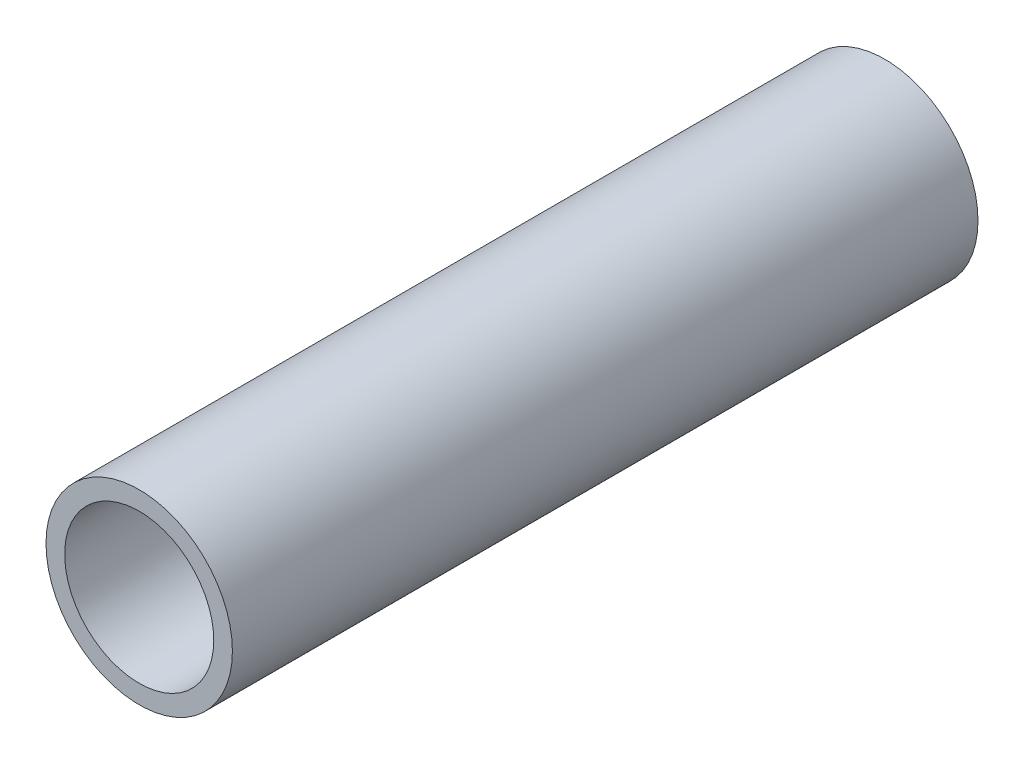
from build123d import *

# Parameters (mm, degrees)
SKETCH2_R           = 63.5
SKETCH2_R_2         = 50.8
BOSS_EXTRUDE1_DEPTH = 508


with BuildPart() as part:
    # Sketch2 → Boss-Extrude1 (new body)
    with BuildSketch(Plane.XY):
        Circle(SKETCH2_R)
        Circle(SKETCH2_R_2, mode=Mode.SUBTRACT)
    extrude(amount=BOSS_EXTRUDE1_DEPTH)


solid = part.part
